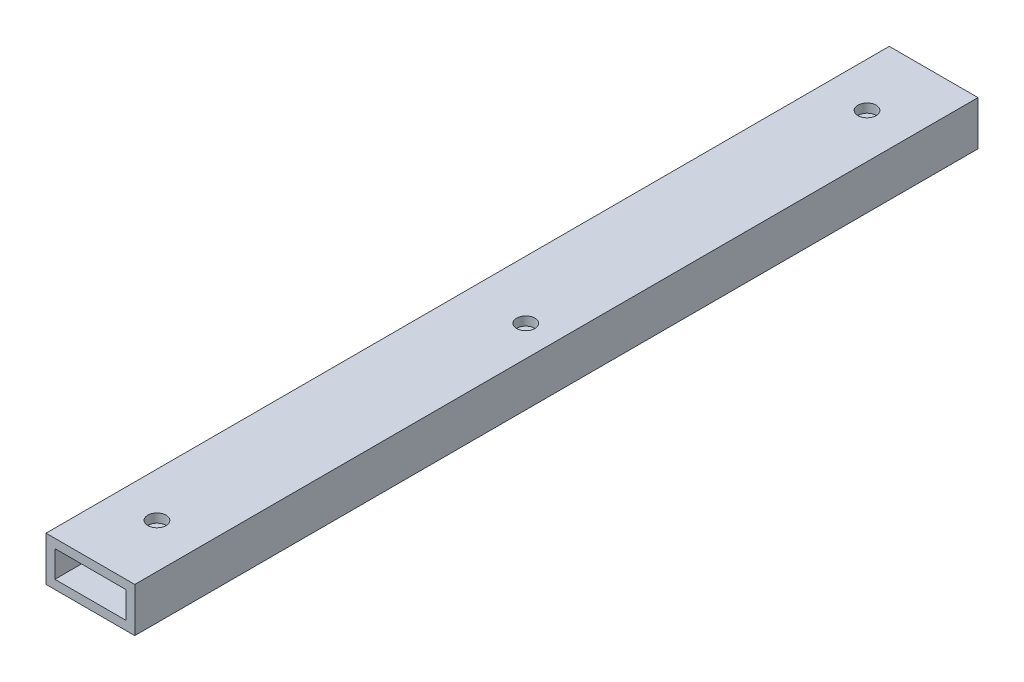
from build123d import *

# Parameters (mm, degrees)
SKETCH_1_W          = 20
SKETCH_1_H          = 10
SKETCH_1_W_2        = 16
SKETCH_1_H_2        = 6
EXTRUDE_1_DEPTH     = 95
SKETCH_3_R          = 2.05
CUT_EXTRUDE_1_DEPTH = 97.050697163


with BuildPart() as part:
    # 草图1 → 凸台-拉伸1 (new, symmetric)
    with BuildSketch(Plane.XY):
        with Locations((0.036753729, 0.03823935)):
            Rectangle(SKETCH_1_W, SKETCH_1_H)
        with Locations((0.036753729, 0.03823935)):
            Rectangle(SKETCH_1_W_2, SKETCH_1_H_2, mode=Mode.SUBTRACT)
    extrude(amount=EXTRUDE_1_DEPTH, both=True)

    # 草图3 → 切除-拉伸1 (cut, through all)
    with BuildSketch(Plane(origin=(0, 5.03823935, 0), x_dir=(1, 0, 0), z_dir=(0, 1, 0))):
        with Locations(Location((3.136753729, 0, 0), (0, 0, 270))):
            Circle(SKETCH_3_R)
        with Locations(Location((0.036753729, 80, 0), (0, 0, 270))):
            Circle(SKETCH_3_R)
        with Locations(Location((0.036753729, -80, 0), (0, 0, 270))):
            Circle(SKETCH_3_R)
    extrude(amount=-CUT_EXTRUDE_1_DEPTH, mode=Mode.SUBTRACT)


solid = part.part
